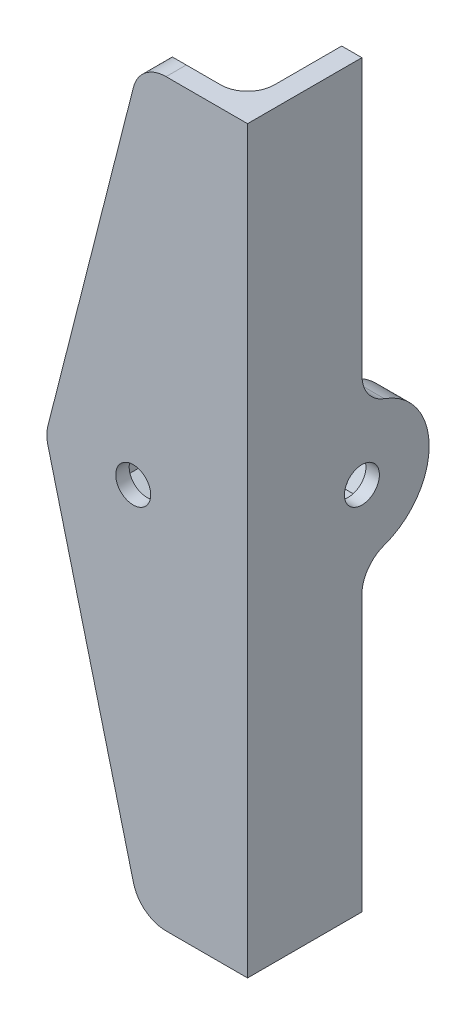
from build123d import *

# Parameters (mm, degrees)
BOSS_EXTRUDE1_DEPTH     = 30
CUT_EXTRUDE1_DEPTH      = 52.961524227
CUT_EXTRUDE1_DEPTH_BACK = 52.961524227
SKETCH2_R               = 2.6
CUT_EXTRUDE2_DEPTH      = 52.961524227
CUT_EXTRUDE2_DEPTH_BACK = 52.961524227
SKETCH3_R               = 2.6
CUT_EXTRUDE3_DEPTH      = 3
CUT_EXTRUDE4_DEPTH      = 3
BOSS_EXTRUDE4_DEPTH     = 40
BOSS_EXTRUDE5_START     = -30
BOSS_EXTRUDE5_DEPTH     = 40
FILLET2_R               = 5
FILLET3_R               = 2
CHAMFER2_SIZE           = 2
CUT_EXTRUDE7_DEPTH      = 81.156097709
CUT_EXTRUDE7_DEPTH_BACK = 81.156097709
FILLET4_R               = 5
CUT_EXTRUDE8_DEPTH      = 80.27168473
CUT_EXTRUDE8_DEPTH_BACK = 80.27168473
FILLET5_R               = 5


with BuildPart() as part:
    # Sketch1 → Boss-Extrude1 (new body)
    with BuildSketch(Plane(origin=(0, 0, 0), x_dir=(1, 0, 0), z_dir=(0, 1, 0))):
        Polygon((0, 0), (30, 0), (30, 30), (25, 30), (25, 5), (0, 5), align=None)
    extrude(amount=BOSS_EXTRUDE1_DEPTH)

    # Sketch2 → Cut-Extrude1 (cut, two sides: drawn at the far end of the back side and taken through both)
    with BuildSketch(Plane.XY.offset(-CUT_EXTRUDE1_DEPTH_BACK)):
        with Locations((13, 15)):
            Circle(SKETCH2_R)
    extrude(amount=CUT_EXTRUDE1_DEPTH + CUT_EXTRUDE1_DEPTH_BACK, mode=Mode.SUBTRACT)

    # Sketch3 → Cut-Extrude2 (cut, two sides: drawn at the far end of the back side and taken through both)
    with BuildSketch(Plane(origin=(30, 0, 0), x_dir=(0, 0, -1), z_dir=(1, 0, 0)).offset(-CUT_EXTRUDE2_DEPTH_BACK)):
        with Locations((17, 15)):
            Circle(SKETCH3_R)
    extrude(amount=CUT_EXTRUDE2_DEPTH + CUT_EXTRUDE2_DEPTH_BACK, mode=Mode.SUBTRACT)

    # Sketch4 → Cut-Extrude3 (cut)
    with BuildSketch(Plane.ZY.offset(-25)):
        Polygon((-21.907477288, 15), (-19.453738644, 10.75), (-14.546261356, 10.75), (-12.092522712, 15), (-14.546261356, 19.25), (-19.453738644, 19.25), align=None)
    extrude(amount=-CUT_EXTRUDE3_DEPTH, mode=Mode.SUBTRACT)

    # Sketch5 → Cut-Extrude4 (cut)
    with BuildSketch(Plane(origin=(0, 0, -5), x_dir=(-1, 0, 0), z_dir=(0, 0, -1))):
        Polygon((-17.1, 17.367136104), (-17.1, 12.632863896), (-13, 10.265727793), (-8.9, 12.632863896), (-8.9, 17.367136104), (-13, 19.734272207), align=None)
    extrude(amount=-CUT_EXTRUDE4_DEPTH, mode=Mode.SUBTRACT)

    # Sketch8 → Boss-Extrude4 (add)
    with BuildSketch(Plane(origin=(0, 30, 0), x_dir=(1, 0, 0), z_dir=(0, 1, 0))):
        Polygon((0, 5), (25, 5), (25, 30), (30, 30), (30, 0), (0, 0), align=None)
    extrude(amount=BOSS_EXTRUDE4_DEPTH)

    # Sketch8<2> → Boss-Extrude5 (add)
    with BuildSketch(Plane(origin=(0, 30, 0), x_dir=(1, 0, 0), z_dir=(0, 1, 0)).offset(BOSS_EXTRUDE5_START)):
        Polygon((0, 5), (25, 5), (25, 30), (30, 30), (30, 0), (0, 0), align=None)
    extrude(amount=-BOSS_EXTRUDE5_DEPTH)

    # Fillet2
    fillet2_edges = [part.edges().sort_by_distance(p)[0] for p in [
        (0, 70, -2.5),
        (27.5, 70, -30),
        (27.5, -40, -30),
        (0, -40, -2.5),
    ]]
    fillet(fillet2_edges, radius=FILLET2_R)

    # Fillet3
    fillet3_edges = [part.edges().sort_by_distance(p)[0] for p in [
        (25, 15, -5),
    ]]
    fillet(fillet3_edges, radius=FILLET3_R)

    # Chamfer2
    chamfer2_edges = [part.edges().sort_by_distance(p)[0] for p in [
        (25, 70, -16),
        (25, 15, -30),
        (25, -40, -16),
        (25, -38.535533906, -28.535533906),
        (25, 68.535533906, -28.535533906),
        (0, 15, -5),
        (1.464466094, -38.535533906, -5),
        (1.464466094, 68.535533906, -5),
        (14, 70, -5),
        (14, -40, -5),
        (24.414213562, -40, -5.585786438),
        (24.414213562, 70, -5.585786438),
    ]]
    chamfer(chamfer2_edges, length=CHAMFER2_SIZE)

    # Sketch11 → Cut-Extrude7 (cut, two sides: drawn at the far end of the back side and taken through both)
    with BuildSketch(Plane.ZY.offset(-25).offset(-CUT_EXTRUDE7_DEPTH_BACK)):
        with BuildLine():
            Line((-17, 25), (-17, 79.176495752))
            Line((-17, 79.176495752), (-82.490941739, 30.916627992))
            Line((-82.490941739, 30.916627992), (-67.497355256, -40.744999046))
            Line((-67.497355256, -40.744999046), (-17, -61.114612426))
            Line((-17, -61.114612426), (-17, 5))
            ThreePointArc((-17, 5), (-27, 15), (-17, 25))
        make_face()
    extrude(amount=CUT_EXTRUDE7_DEPTH + CUT_EXTRUDE7_DEPTH_BACK, mode=Mode.SUBTRACT)

    # Fillet4
    fillet4_edges = [part.edges().sort_by_distance(p)[0] for p in [
        (27.5, 25, -17),
        (27.5, 5, -17),
    ]]
    fillet(fillet4_edges, radius=FILLET4_R)

    # Sketch12 → Cut-Extrude8 (cut, two sides: drawn at the far end of the back side and taken through both)
    with BuildSketch(Plane(origin=(0, 0, -5), x_dir=(-1, 0, 0), z_dir=(0, 0, -1)).offset(-CUT_EXTRUDE8_DEPTH_BACK)):
        Polygon((-14, 70), (0, 15), (-14, -40), (29.605001417, -51.099454906), (59.954696555, 7.95039026), (29.605001417, 77.986583132), (-23, 76.936040239), align=None)
    extrude(amount=CUT_EXTRUDE8_DEPTH + CUT_EXTRUDE8_DEPTH_BACK, mode=Mode.SUBTRACT)

    # Fillet5
    fillet5_edges = [part.edges().sort_by_distance(p)[0] for p in [
        (14, -40, -1.5),
        (14, 70, -1.5),
        (0, 15, -1.5),
    ]]
    fillet(fillet5_edges, radius=FILLET5_R)


solid = part.part
